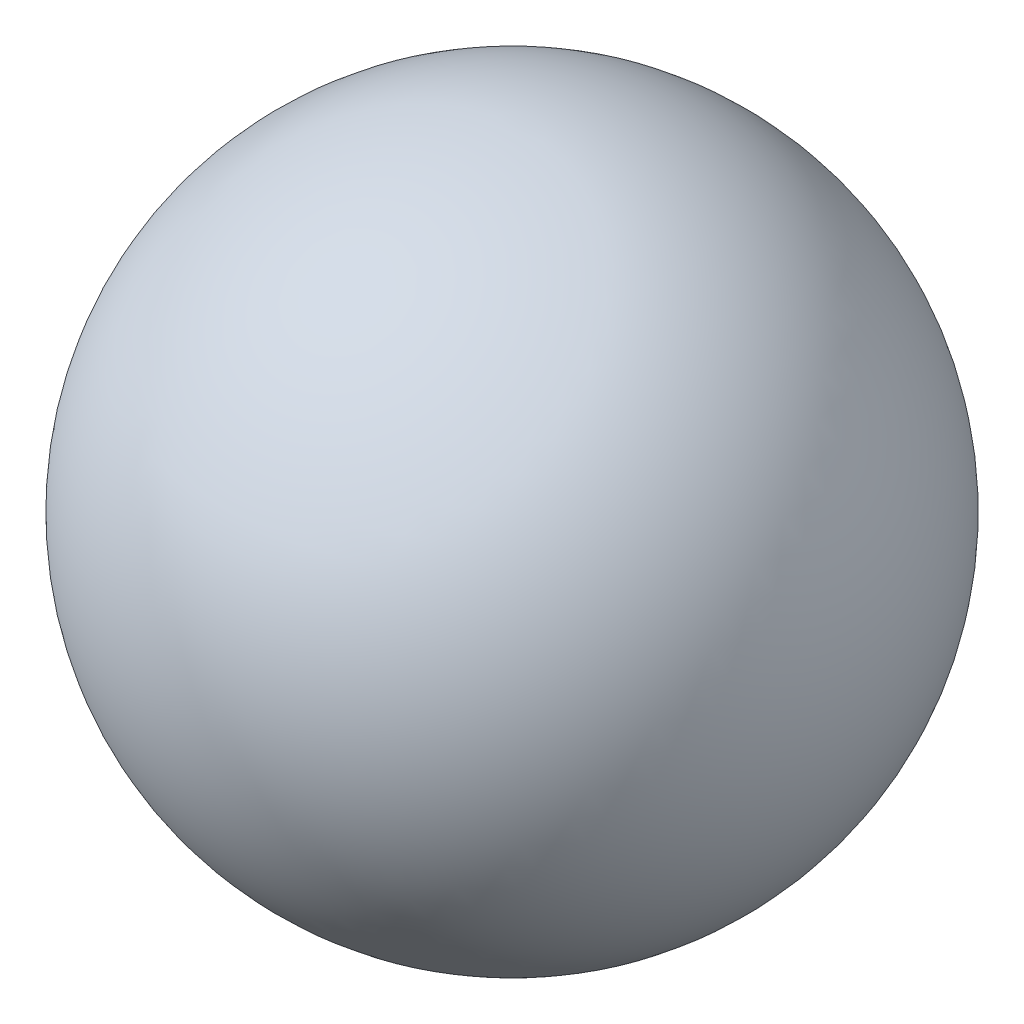
from build123d import *


with BuildPart() as part:
    # Sketch1 → Revolve1 (revolve)
    with BuildSketch(Plane.XY):
        with BuildLine():
            Line((0, 3.1496), (0, 0))
            ThreePointArc((0, 0), (-1.5748, 1.5748), (0, 3.1496))
        make_face()
    revolve(axis=Axis((0, 3.1496, 0), (0, -1, 0)))


solid = part.part
